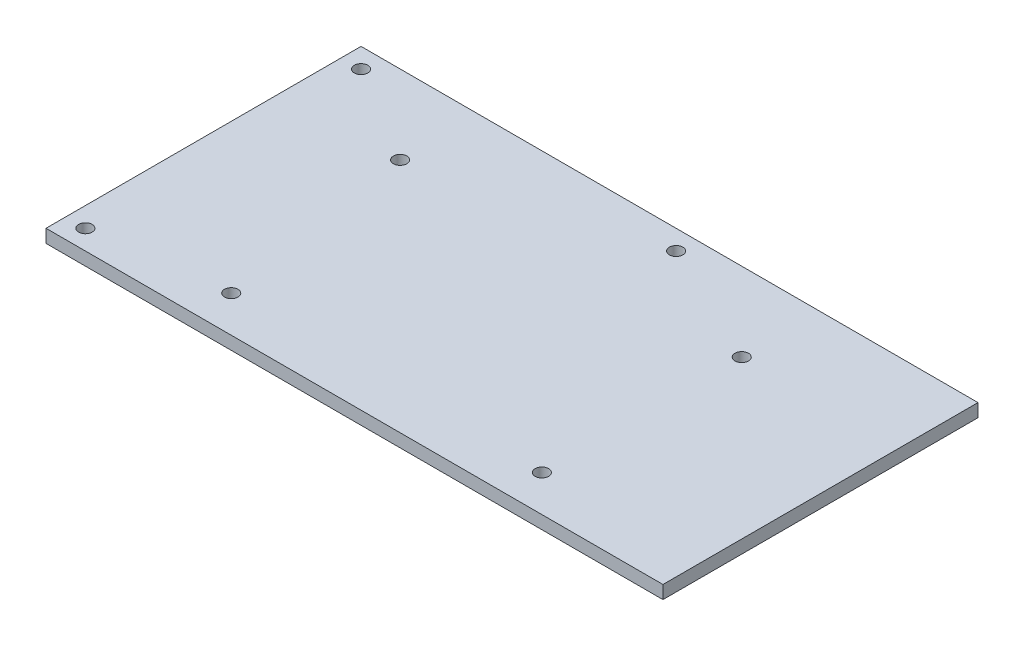
from build123d import *

# Parameters (mm, degrees)
BASE_SKETCH_W                              = 149.225
BASE_SKETCH_H                              = 76.2
BASE_PLATE_DEPTH                           = 3.175
F_4_40_GUIDE_RAIL_HOLES_REACH              = 85.837
F_4_40_HOLE_PATTERN_SKETCH_GUIDE_RAIL_R    = 1.63195
F_4_40_ARDUINO_HOLES_REACH                 = 85.837
F_4_40_HOLE_PATTERN_SKETCH_ARDUINO_HOLES_R = 1.63195


with BuildPart() as part:
    # Base Sketch → Base Plate (new body)
    with BuildSketch(Plane(origin=(0, 0, 0), x_dir=(1, 0, 0), z_dir=(0, 1, 0))):
        Rectangle(BASE_SKETCH_W, BASE_SKETCH_H)
    extrude(amount=BASE_PLATE_DEPTH)

    # 4-40 Hole Pattern Sketch (Guide Rail) → 4-40 Guide Rail Holes (cut, up to next)
    with BuildSketch(Plane(origin=(0, 3.175, 0), x_dir=(1, 0, 0), z_dir=(0, 1, 0)), mode=Mode.PRIVATE) as f_4_40_guide_rail_holes_sk1:
        with Locations(Location((-69.85, 33.3375, 0), (0, 0, 270))):
            Circle(F_4_40_HOLE_PATTERN_SKETCH_GUIDE_RAIL_R)
    f_4_40_guide_rail_holes_tool1 = extrude(f_4_40_guide_rail_holes_sk1.sketch, amount=-F_4_40_GUIDE_RAIL_HOLES_REACH, mode=Mode.PRIVATE) & part.part
    # 4-40 Hole Pattern Sketch (Guide Rail) → 4-40 Guide Rail Holes (cut, up to next)
    with BuildSketch(Plane(origin=(0, 3.175, 0), x_dir=(1, 0, 0), z_dir=(0, 1, 0)), mode=Mode.PRIVATE) as f_4_40_guide_rail_holes_sk2:
        with Locations(Location((-69.85, -33.3375, 0), (0, 0, 270))):
            Circle(F_4_40_HOLE_PATTERN_SKETCH_GUIDE_RAIL_R)
    f_4_40_guide_rail_holes_tool2 = extrude(f_4_40_guide_rail_holes_sk2.sketch, amount=-F_4_40_GUIDE_RAIL_HOLES_REACH, mode=Mode.PRIVATE) & part.part
    # 4-40 Hole Pattern Sketch (Guide Rail) → 4-40 Guide Rail Holes (cut, up to next)
    with BuildSketch(Plane(origin=(0, 3.175, 0), x_dir=(1, 0, 0), z_dir=(0, 1, 0)), mode=Mode.PRIVATE) as f_4_40_guide_rail_holes_sk3:
        with Locations(Location((6.35, 33.3375, 0), (0, 0, 270))):
            Circle(F_4_40_HOLE_PATTERN_SKETCH_GUIDE_RAIL_R)
    f_4_40_guide_rail_holes_tool3 = extrude(f_4_40_guide_rail_holes_sk3.sketch, amount=-F_4_40_GUIDE_RAIL_HOLES_REACH, mode=Mode.PRIVATE) & part.part
    add(f_4_40_guide_rail_holes_tool1.solids().sort_by_distance((-69.85, 3.175, -33.3375))[0], mode=Mode.SUBTRACT)
    add(f_4_40_guide_rail_holes_tool2.solids().sort_by_distance((-69.85, 3.175, 33.3375))[0], mode=Mode.SUBTRACT)
    add(f_4_40_guide_rail_holes_tool3.solids().sort_by_distance((6.35, 3.175, -33.3375))[0], mode=Mode.SUBTRACT)

    # 4-40 Hole Pattern Sketch (Arduino Holes) → 4-40 Arduino Holes (cut, up to next)
    with BuildSketch(Plane(origin=(0, 3.175, 0), x_dir=(1, 0, 0), z_dir=(0, 1, 0)), mode=Mode.PRIVATE) as f_4_40_arduino_holes_sk1:
        with Locations(Location((-46.1137, 19.05, 0), (0, 0, 270))):
            Circle(F_4_40_HOLE_PATTERN_SKETCH_ARDUINO_HOLES_R)
    f_4_40_arduino_holes_tool1 = extrude(f_4_40_arduino_holes_sk1.sketch, amount=-F_4_40_ARDUINO_HOLES_REACH, mode=Mode.PRIVATE) & part.part
    # 4-40 Hole Pattern Sketch (Arduino Holes) → 4-40 Arduino Holes (cut, up to next)
    with BuildSketch(Plane(origin=(0, 3.175, 0), x_dir=(1, 0, 0), z_dir=(0, 1, 0)), mode=Mode.PRIVATE) as f_4_40_arduino_holes_sk2:
        with Locations(Location((-38.6207, -29.2862, 0), (0, 0, 270))):
            Circle(F_4_40_HOLE_PATTERN_SKETCH_ARDUINO_HOLES_R)
    f_4_40_arduino_holes_tool2 = extrude(f_4_40_arduino_holes_sk2.sketch, amount=-F_4_40_ARDUINO_HOLES_REACH, mode=Mode.PRIVATE) & part.part
    # 4-40 Hole Pattern Sketch (Arduino Holes) → 4-40 Arduino Holes (cut, up to next)
    with BuildSketch(Plane(origin=(0, 3.175, 0), x_dir=(1, 0, 0), z_dir=(0, 1, 0)), mode=Mode.PRIVATE) as f_4_40_arduino_holes_sk3:
        with Locations(Location((36.5125, 19.05, 0), (0, 0, 270))):
            Circle(F_4_40_HOLE_PATTERN_SKETCH_ARDUINO_HOLES_R)
    f_4_40_arduino_holes_tool3 = extrude(f_4_40_arduino_holes_sk3.sketch, amount=-F_4_40_ARDUINO_HOLES_REACH, mode=Mode.PRIVATE) & part.part
    # 4-40 Hole Pattern Sketch (Arduino Holes) → 4-40 Arduino Holes (cut, up to next)
    with BuildSketch(Plane(origin=(0, 3.175, 0), x_dir=(1, 0, 0), z_dir=(0, 1, 0)), mode=Mode.PRIVATE) as f_4_40_arduino_holes_sk4:
        with Locations(Location((36.5125, -29.2862, 0), (0, 0, 270))):
            Circle(F_4_40_HOLE_PATTERN_SKETCH_ARDUINO_HOLES_R)
    f_4_40_arduino_holes_tool4 = extrude(f_4_40_arduino_holes_sk4.sketch, amount=-F_4_40_ARDUINO_HOLES_REACH, mode=Mode.PRIVATE) & part.part
    add(f_4_40_arduino_holes_tool1.solids().sort_by_distance((-46.1137, 3.175, -19.05))[0], mode=Mode.SUBTRACT)
    add(f_4_40_arduino_holes_tool2.solids().sort_by_distance((-38.6207, 3.175, 29.2862))[0], mode=Mode.SUBTRACT)
    add(f_4_40_arduino_holes_tool3.solids().sort_by_distance((36.5125, 3.175, -19.05))[0], mode=Mode.SUBTRACT)
    add(f_4_40_arduino_holes_tool4.solids().sort_by_distance((36.5125, 3.175, 29.2862))[0], mode=Mode.SUBTRACT)


solid = part.part
